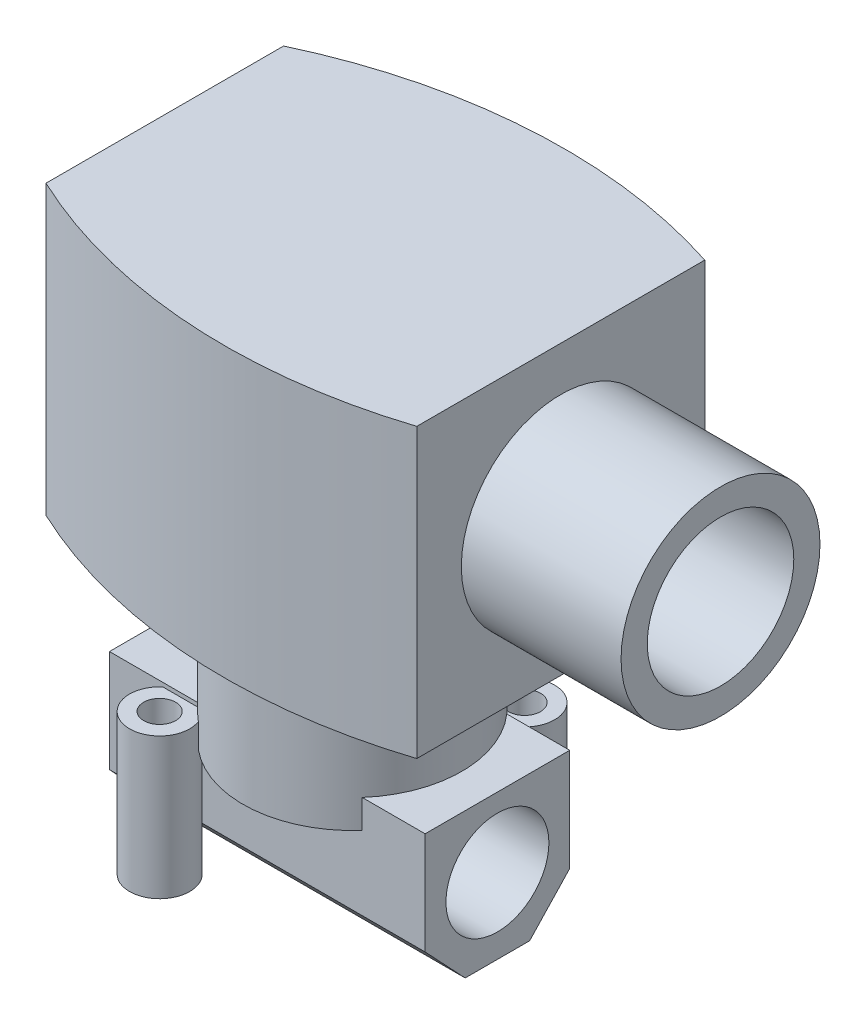
from build123d import *

# Parameters (mm, degrees)
BOSS_EXTRUDE1_DEPTH        = 36.33
SKETCH2_R                  = 12.56
SKETCH2_R_2                = 9.25
BOSS_EXTRUDE2_DEPTH        = 20.17
SKETCH3_R                  = 13.815
BOSS_EXTRUDE3_DEPTH        = 20.35
BOSS_EXTRUDE4_DEPTH        = 47.86
CUT_EXTRUDE1_DEPTH         = 8.000000034
SKETCH6_R                  = 6.5
CUT_EXTRUDE2_DEPTH         = 86.564913353
SKETCH7_R                  = 3.8
BOSS_EXTRUDE5_DEPTH        = 17.8
F_10_32_TAPPED_HOLE1_D     = 4.0386
F_10_32_TAPPED_HOLE1_DEPTH = 17.8


with BuildPart() as part:
    # Sketch1 → Boss-Extrude1 (new body)
    with BuildSketch(Plane(origin=(0, 0, 0), x_dir=(1, 0, 0), z_dir=(0, 1, 0))):
        with BuildLine():
            Line((-25, 15), (-25, -15))
            ThreePointArc((-25, -15), (-0.303555948, -21.362892261), (25, -18.18))
            Line((25, -18.18), (25, 18.18))
            ThreePointArc((25, 18.18), (-0.303555948, 21.362892261), (-25, 15))
        make_face()
    extrude(amount=-BOSS_EXTRUDE1_DEPTH)

    # Sketch2 → Boss-Extrude2 (add)
    with BuildSketch(Plane(origin=(25, 0, 0), x_dir=(0, 0, -1), z_dir=(1, 0, 0))):
        with Locations((0, -18.165)):
            Circle(SKETCH2_R)
        with Locations((0, -18.165)):
            Circle(SKETCH2_R_2, mode=Mode.SUBTRACT)
    extrude(amount=BOSS_EXTRUDE2_DEPTH)

    # Sketch3 → Boss-Extrude3 (add)
    with BuildSketch(Plane.XZ.offset(36.33)):
        with Locations(Location((-1.315, 0, 0), (0, 0, 270))):
            Circle(SKETCH3_R)
    extrude(amount=BOSS_EXTRUDE3_DEPTH)

    # Sketch4 → Boss-Extrude4 (add)
    with BuildSketch(Plane(origin=(25, 0, 0), x_dir=(0, 0, -1), z_dir=(1, 0, 0))):
        Polygon((-9.13, -66), (-9.13, -53.08), (9.13, -53.08), (9.13, -66), (4.07, -71.38), (-4.07, -71.38), align=None)
    extrude(amount=-BOSS_EXTRUDE4_DEPTH)

    # Sketch5 → Cut-Extrude1 (cut)
    with BuildSketch(Plane(origin=(25, 0, 0), x_dir=(0, 0, -1), z_dir=(1, 0, 0))):
        Polygon((-9.13, -66), (-4.07, -71.38), (4.07, -71.38), (9.13, -66), (9.13, -53.08), (-9.13, -53.08), align=None)
    extrude(amount=-CUT_EXTRUDE1_DEPTH, mode=Mode.SUBTRACT)

    # Sketch6 → Cut-Extrude2 (cut, through all)
    with BuildSketch(Plane(origin=(16.999999966, 0, 0), x_dir=(0, 0, -1), z_dir=(1, 0, 0))):
        with Locations((0, -61.881671093)):
            Circle(SKETCH6_R)
    extrude(amount=-CUT_EXTRUDE2_DEPTH, mode=Mode.SUBTRACT)

    # Sketch7 → Boss-Extrude5 (add)
    with BuildSketch(Plane.XZ.offset(71.38)):
        with Locations(Location((-13.64, 12.01, 0), (0, 0, 270))):
            Circle(SKETCH7_R)
        with Locations(Location((8.41, -12.01, 0), (0, 0, 270))):
            Circle(SKETCH7_R)
    extrude(amount=-BOSS_EXTRUDE5_DEPTH)

    # #10-32 Tapped Hole1
    with Locations(Plane(origin=(0, -71.38, 0), x_dir=(-1, 0, 0), z_dir=(0, -1, 0))):
        with Locations((13.64, -12.01), (-8.41, 12.01)):
            Hole(F_10_32_TAPPED_HOLE1_D / 2, depth=F_10_32_TAPPED_HOLE1_DEPTH)


solid = part.part
